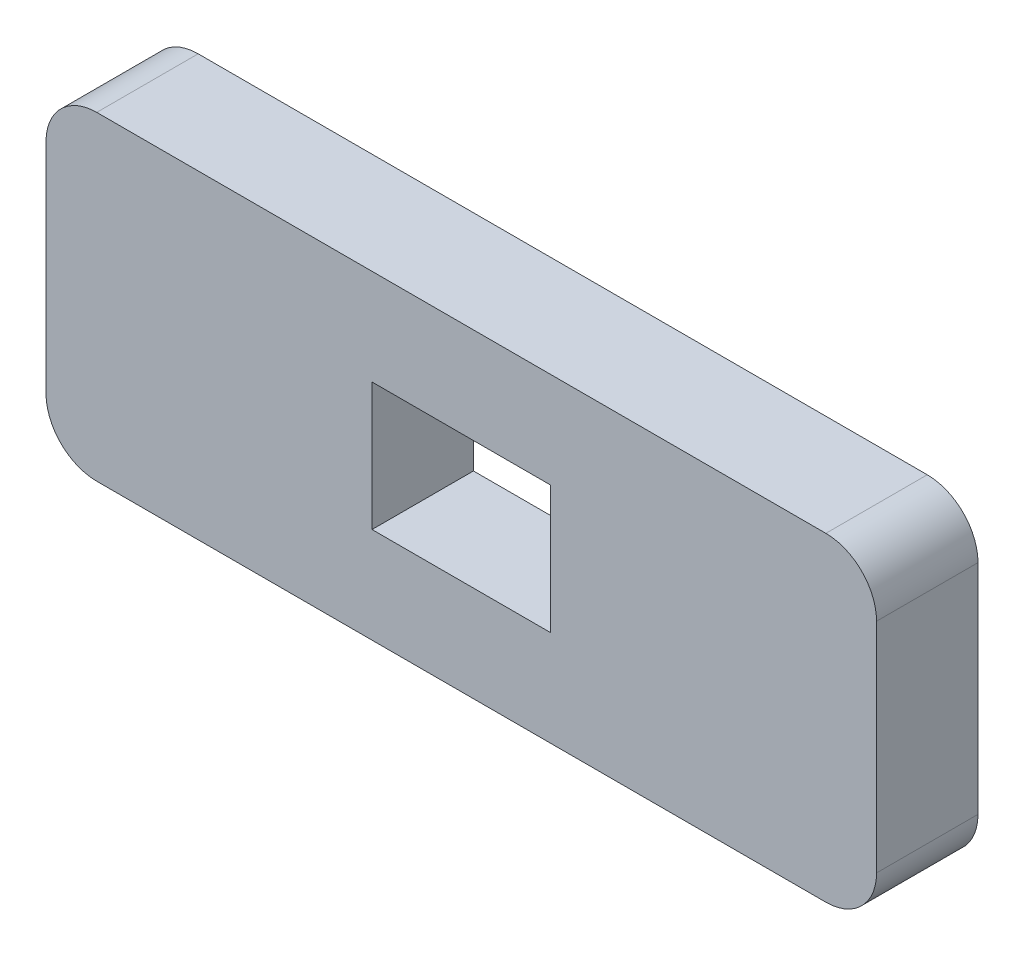
from build123d import *

# Parameters (mm, degrees)
BOSS_EXTRUDE1_DEPTH = 1.5875
SKETCH2_W           = 2.794
SKETCH2_H           = 2
CUT_EXTRUDE1_DEPTH  = 8.142839509


with BuildPart() as part:
    # Sketch1 → Boss-Extrude1 (new body)
    with BuildSketch(Plane.XY):
        with BuildLine():
            Line((-5.706, -2.5), (5.706, -2.5))
            ThreePointArc((5.706, -2.5), (6.267442784, -2.267442784), (6.5, -1.706))
            Line((6.5, -1.706), (6.5, 1.706))
            ThreePointArc((6.5, 1.706), (6.267442784, 2.267442784), (5.706, 2.5))
            Line((5.706, 2.5), (-5.706, 2.5))
            ThreePointArc((-5.706, 2.5), (-6.267442784, 2.267442784), (-6.5, 1.706))
            Line((-6.5, 1.706), (-6.5, -1.706))
            ThreePointArc((-6.5, -1.706), (-6.267442784, -2.267442784), (-5.706, -2.5))
        make_face()
    extrude(amount=BOSS_EXTRUDE1_DEPTH)

    # Sketch2 → Cut-Extrude1 (cut, through all)
    with BuildSketch(Plane.XY.offset(1.5875)):
        Rectangle(SKETCH2_W, SKETCH2_H)
    extrude(amount=-CUT_EXTRUDE1_DEPTH, mode=Mode.SUBTRACT)


solid = part.part
